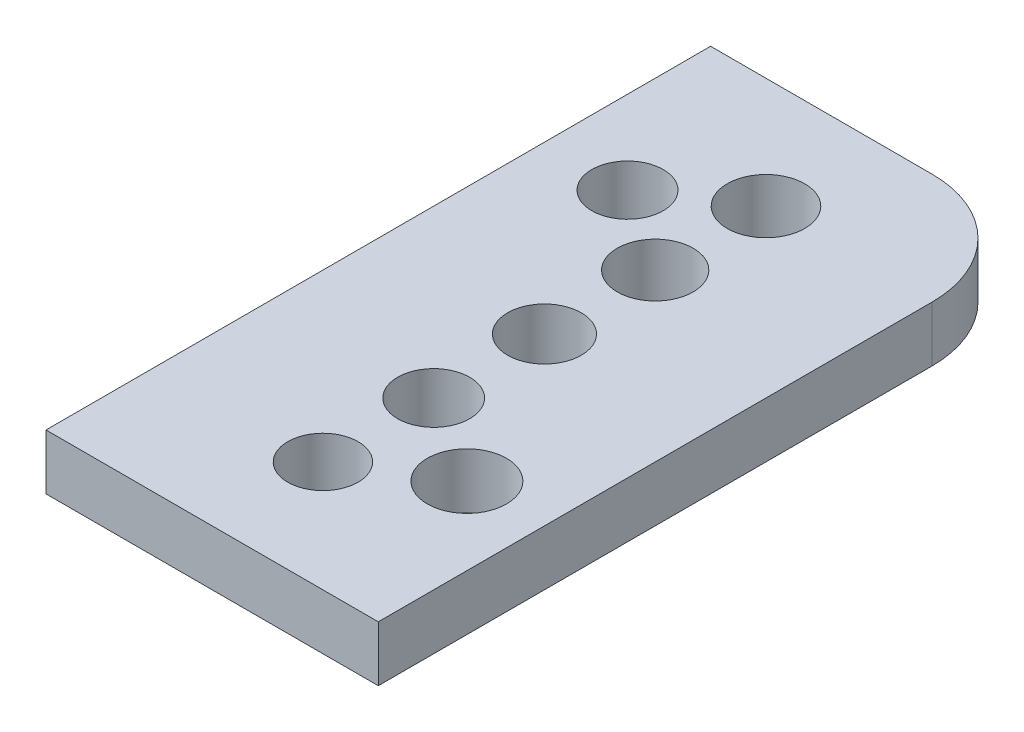
from build123d import *

# Parameters (mm, degrees)
ESQUISSE1_W             = 30
ESQUISSE1_H             = 60
BOSS_EXTRU_1_DEPTH      = 5
ENL_V_MAT_EXTRU_1_REACH = 35.912
ESQUISSE2_R             = 3.175
ESQUISSE2_R_2           = 3.25
ESQUISSE2_R_3           = 3.325
ESQUISSE2_R_4           = 3.425
ESQUISSE2_R_5           = 3.5
ESQUISSE2_R_6           = 3.575
ESQUISSE2_R_7           = 3.225
CONG_1_R                = 10


with BuildPart() as part:
    # Esquisse1 → Boss.-Extru.1 (new body)
    with BuildSketch(Plane(origin=(0, 0, 0), x_dir=(1, 0, 0), z_dir=(0, 1, 0))):
        Rectangle(ESQUISSE1_W, ESQUISSE1_H)
    extrude(amount=BOSS_EXTRU_1_DEPTH)

    # Esquisse2 → Enlèv. mat.-Extru.1 (cut, up to next)
    with BuildSketch(Plane(origin=(0, 5, 0), x_dir=(1, 0, 0), z_dir=(0, 1, 0)), mode=Mode.PRIVATE) as enl_v_mat_extru_1_sk1:
        with Locations(Location((0, -20, 0), (0, 0, 270))):
            Circle(ESQUISSE2_R)
    enl_v_mat_extru_1_tool1 = extrude(enl_v_mat_extru_1_sk1.sketch, amount=-ENL_V_MAT_EXTRU_1_REACH, mode=Mode.PRIVATE) & part.part
    # Esquisse2 → Enlèv. mat.-Extru.1 (cut, up to next)
    with BuildSketch(Plane(origin=(0, 5, 0), x_dir=(1, 0, 0), z_dir=(0, 1, 0)), mode=Mode.PRIVATE) as enl_v_mat_extru_1_sk2:
        with Locations(Location((0, -10, 0), (0, 0, 270))):
            Circle(ESQUISSE2_R_2)
    enl_v_mat_extru_1_tool2 = extrude(enl_v_mat_extru_1_sk2.sketch, amount=-ENL_V_MAT_EXTRU_1_REACH, mode=Mode.PRIVATE) & part.part
    # Esquisse2 → Enlèv. mat.-Extru.1 (cut, up to next)
    with BuildSketch(Plane(origin=(0, 5, 0), x_dir=(1, 0, 0), z_dir=(0, 1, 0)), mode=Mode.PRIVATE) as enl_v_mat_extru_1_sk3:
        with Locations(Location((0, 0, 0), (0, 0, 270))):
            Circle(ESQUISSE2_R_3)
    enl_v_mat_extru_1_tool3 = extrude(enl_v_mat_extru_1_sk3.sketch, amount=-ENL_V_MAT_EXTRU_1_REACH, mode=Mode.PRIVATE) & part.part
    # Esquisse2 → Enlèv. mat.-Extru.1 (cut, up to next)
    with BuildSketch(Plane(origin=(0, 5, 0), x_dir=(1, 0, 0), z_dir=(0, 1, 0)), mode=Mode.PRIVATE) as enl_v_mat_extru_1_sk4:
        with Locations(Location((0, 10, 0), (0, 0, 270))):
            Circle(ESQUISSE2_R_4)
    enl_v_mat_extru_1_tool4 = extrude(enl_v_mat_extru_1_sk4.sketch, amount=-ENL_V_MAT_EXTRU_1_REACH, mode=Mode.PRIVATE) & part.part
    # Esquisse2 → Enlèv. mat.-Extru.1 (cut, up to next)
    with BuildSketch(Plane(origin=(0, 5, 0), x_dir=(1, 0, 0), z_dir=(0, 1, 0)), mode=Mode.PRIVATE) as enl_v_mat_extru_1_sk5:
        with Locations(Location((0, 20, 0), (0, 0, 270))):
            Circle(ESQUISSE2_R_5)
    enl_v_mat_extru_1_tool5 = extrude(enl_v_mat_extru_1_sk5.sketch, amount=-ENL_V_MAT_EXTRU_1_REACH, mode=Mode.PRIVATE) & part.part
    # Esquisse2 → Enlèv. mat.-Extru.1 (cut, up to next)
    with BuildSketch(Plane(origin=(0, 5, 0), x_dir=(1, 0, 0), z_dir=(0, 1, 0)), mode=Mode.PRIVATE) as enl_v_mat_extru_1_sk6:
        with Locations(Location((8, -15, 0), (0, 0, 270))):
            Circle(ESQUISSE2_R_6)
    enl_v_mat_extru_1_tool6 = extrude(enl_v_mat_extru_1_sk6.sketch, amount=-ENL_V_MAT_EXTRU_1_REACH, mode=Mode.PRIVATE) & part.part
    # Esquisse2 → Enlèv. mat.-Extru.1 (cut, up to next)
    with BuildSketch(Plane(origin=(0, 5, 0), x_dir=(1, 0, 0), z_dir=(0, 1, 0)), mode=Mode.PRIVATE) as enl_v_mat_extru_1_sk7:
        with Locations(Location((-7.5, 15, 0), (0, 0, 270))):
            Circle(ESQUISSE2_R_7)
    enl_v_mat_extru_1_tool7 = extrude(enl_v_mat_extru_1_sk7.sketch, amount=-ENL_V_MAT_EXTRU_1_REACH, mode=Mode.PRIVATE) & part.part
    add(enl_v_mat_extru_1_tool1.solids().sort_by_distance((0, 5, 20))[0], mode=Mode.SUBTRACT)
    add(enl_v_mat_extru_1_tool2.solids().sort_by_distance((0, 5, 10))[0], mode=Mode.SUBTRACT)
    add(enl_v_mat_extru_1_tool3.solids().sort_by_distance((0, 5, 0))[0], mode=Mode.SUBTRACT)
    add(enl_v_mat_extru_1_tool4.solids().sort_by_distance((0, 5, -10))[0], mode=Mode.SUBTRACT)
    add(enl_v_mat_extru_1_tool5.solids().sort_by_distance((0, 5, -20))[0], mode=Mode.SUBTRACT)
    add(enl_v_mat_extru_1_tool6.solids().sort_by_distance((8, 5, 15))[0], mode=Mode.SUBTRACT)
    add(enl_v_mat_extru_1_tool7.solids().sort_by_distance((-7.5, 5, -15))[0], mode=Mode.SUBTRACT)

    # Congé1
    cong_1_edges = [part.edges().sort_by_distance(p)[0] for p in [
        (15, 2.5, -30),
    ]]
    fillet(cong_1_edges, radius=CONG_1_R)


solid = part.part
